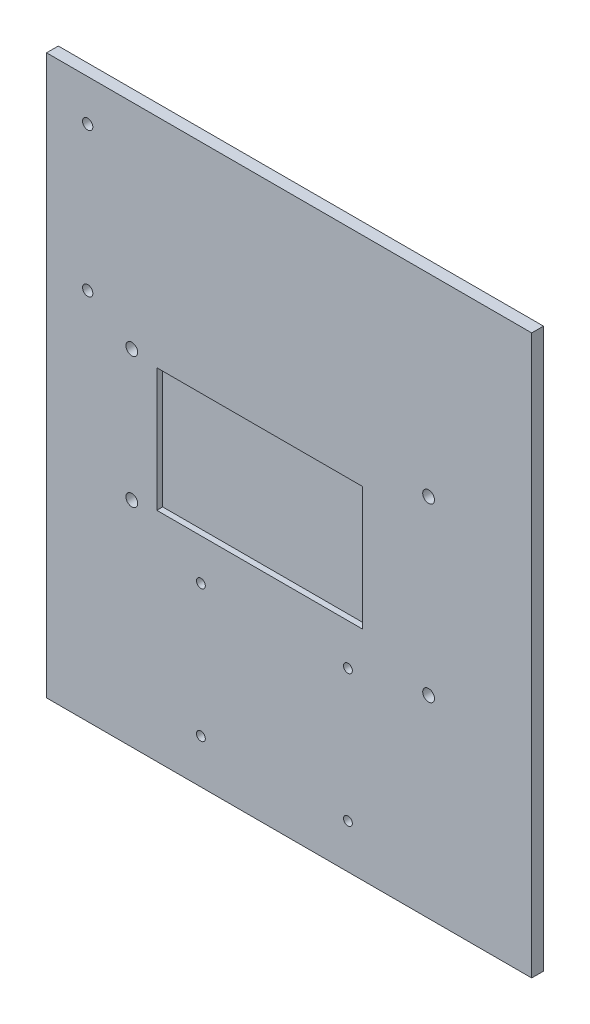
from build123d import *

# Parameters (mm, degrees)
ESQUISSE1_W             = 165
ESQUISSE1_H             = 190
BOSS_EXTRU_1_DEPTH      = 4
ESQUISSE2_R             = 2
ENL_V_MAT_EXTRU_1_DEPTH = 10
ESQUISSE3_R             = 1.75
ENL_V_MAT_EXTRU_2_DEPTH = 10
ESQUISSE4_R             = 1.5
ENL_V_MAT_EXTRU_3_DEPTH = 10
ESQUISSE5_W             = 70
ESQUISSE5_H             = 42
ENL_V_MAT_EXTRU_4_DEPTH = 2


with BuildPart() as part:
    # Esquisse1 → Boss.-Extru.1 (new body)
    with BuildSketch(Plane.XY):
        with Locations((82.5, 95)):
            Rectangle(ESQUISSE1_W, ESQUISSE1_H)
    extrude(amount=BOSS_EXTRU_1_DEPTH)

    # Esquisse2 → Enlèv. mat.-Extru.1 (cut)
    with BuildSketch(Plane(origin=(0, 0, 0), x_dir=(-1, 0, 0), z_dir=(0, 0, -1))):
        with Locations((-129.934319196, 124.25)):
            Circle(ESQUISSE2_R)
        with Locations((-29, 117.25)):
            Circle(ESQUISSE2_R)
        with Locations((-29, 72.75)):
            Circle(ESQUISSE2_R)
        with Locations((-129.934319196, 65.75)):
            Circle(ESQUISSE2_R)
    extrude(amount=-ENL_V_MAT_EXTRU_1_DEPTH, mode=Mode.SUBTRACT)

    # Esquisse3 → Enlèv. mat.-Extru.2 (cut)
    with BuildSketch(Plane.XY.offset(4)):
        with Locations((14, 176)):
            Circle(ESQUISSE3_R)
        with Locations((14, 127)):
            Circle(ESQUISSE3_R)
    extrude(amount=-ENL_V_MAT_EXTRU_2_DEPTH, mode=Mode.SUBTRACT)

    # Esquisse4 → Enlèv. mat.-Extru.3 (cut)
    with BuildSketch(Plane.XY.offset(4)):
        with Locations((52.5, 15)):
            Circle(ESQUISSE4_R)
        with Locations((52.5, 60)):
            Circle(ESQUISSE4_R)
        with Locations((102.5, 60)):
            Circle(ESQUISSE4_R)
        with Locations((102.5, 15)):
            Circle(ESQUISSE4_R)
    extrude(amount=-ENL_V_MAT_EXTRU_3_DEPTH, mode=Mode.SUBTRACT)

    # Esquisse5 → Enlèv. mat.-Extru.4 (cut)
    with BuildSketch(Plane.XY.offset(4)):
        with Locations((72.5, 95)):
            Rectangle(ESQUISSE5_W, ESQUISSE5_H)
    extrude(amount=-ENL_V_MAT_EXTRU_4_DEPTH, mode=Mode.SUBTRACT)


solid = part.part
